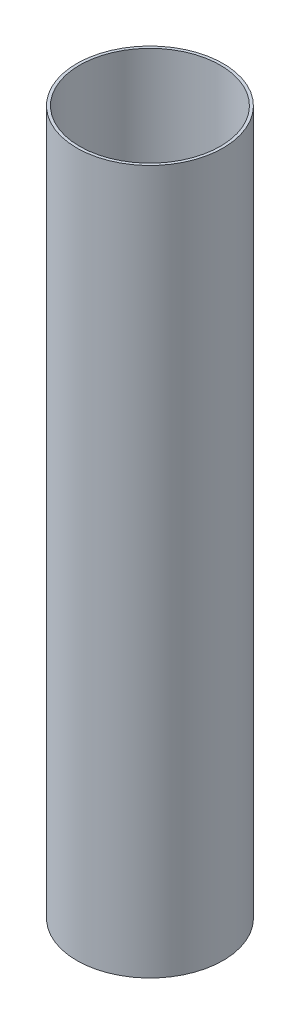
from build123d import *

# Parameters (mm, degrees)
SKETCH2_R           = 39.624
SKETCH2_R_2         = 38.1
BOSS_EXTRUDE1_DEPTH = 381


with BuildPart() as part:
    # Sketch2 → Boss-Extrude1 (new body)
    with BuildSketch(Plane(origin=(0, 0, 0), x_dir=(1, 0, 0), z_dir=(0, 1, 0))):
        with Locations(Location((0, 0, 0), (0, 0, 270))):
            Circle(SKETCH2_R)
        with Locations(Location((0, 0, 0), (0, 0, 270))):
            Circle(SKETCH2_R_2, mode=Mode.SUBTRACT)
    extrude(amount=BOSS_EXTRUDE1_DEPTH)


solid = part.part
